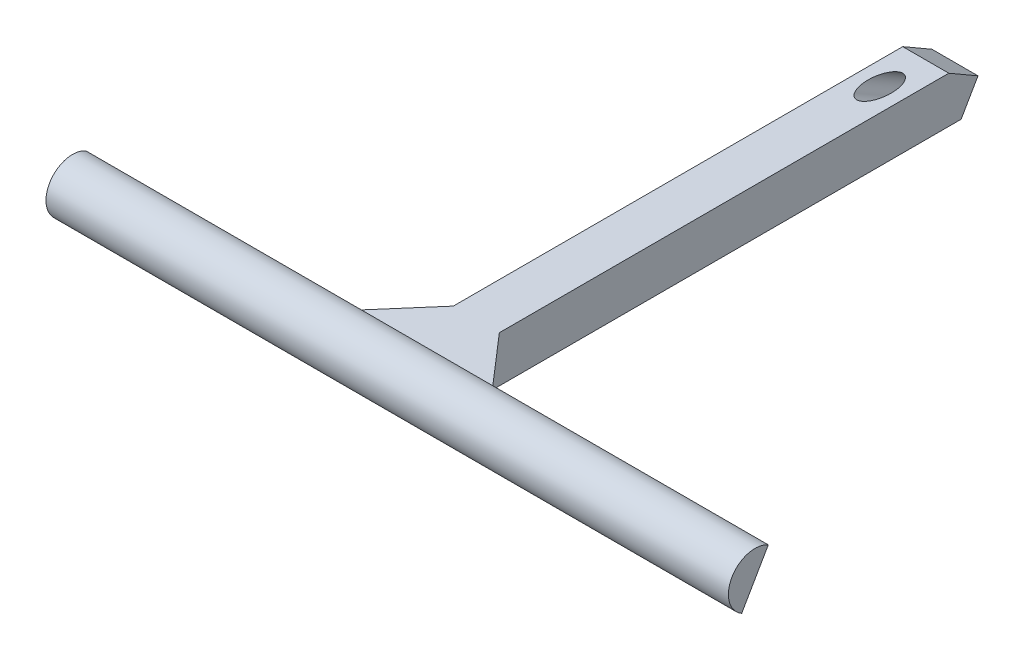
from build123d import *

# Parameters (mm, degrees)
SKETCH_1_W               = 5.4
SKETCH_1_H               = 65
EXTRUDE_1_DEPTH          = 2.7
CUT_EXTRUDE_1_DEPTH      = 33.723538928
CUT_EXTRUDE_1_DEPTH_BACK = 33.723538928
EXTRUDE_2_DEPTH          = 40
CHAMFER_1_SIZE           = 5
CUT_EXTRUDE_2_DEPTH      = 73.576392116
CUT_EXTRUDE_2_DEPTH_BACK = 73.576392116
SKETCH_6_R               = 1.35


with BuildPart() as part:
    # 草图1 → 凸台-拉伸1 (new, symmetric)
    with BuildSketch(Plane(origin=(0, 0, 0), x_dir=(1, 0, 0), z_dir=(0, 1, 0))):
        Rectangle(SKETCH_1_W, SKETCH_1_H)
    extrude(amount=EXTRUDE_1_DEPTH, both=True)

    # 草图3 → 切除-拉伸1 (cut, two sides: drawn at the far end of the back side and taken through both)
    with BuildSketch(Plane(origin=(0, 0, 0), x_dir=(0, 0, -1), z_dir=(1, 0, 0)).offset(-CUT_EXTRUDE_1_DEPTH_BACK)):
        Polygon((29.07653718, 2.7), (32.5, 0.72346282), (32.5, 2.7), align=None)
        Polygon((32.5, -2.7), (32.5, 0.72346282), (30.52346282, -2.7), align=None)
    extrude(amount=CUT_EXTRUDE_1_DEPTH + CUT_EXTRUDE_1_DEPTH_BACK, mode=Mode.SUBTRACT)

    # 草图4 → 凸台-拉伸2 (add, symmetric)
    with BuildSketch(Plane(origin=(0, 0, 0), x_dir=(0, 0, -1), z_dir=(1, 0, 0))):
        with BuildLine():
            ThreePointArc((-29.382308546, 2.7), (-33.641154273, 1.558845727), (-32.5, -2.7))
            Line((-32.5, -2.7), (-29.382308546, 2.7))
        make_face()
    extrude(amount=EXTRUDE_2_DEPTH, both=True)

    # 倒角1
    chamfer_1_edges = [part.edges().sort_by_distance(p)[0] for p in [
        (-2.7, 0, 30.941154273),
        (2.7, 0, 30.941154273),
    ]]
    chamfer(chamfer_1_edges, length=CHAMFER_1_SIZE)

    # 草图6 → 切除-拉伸2 (cut, two sides: drawn at the far end of the back side and taken through both)
    with BuildSketch(Plane(origin=(0, -13.892047107, -24.06173141), x_dir=(-1, 0, 0), z_dir=(0, -0.4999999999999933, -0.8660254037844425)).offset(-CUT_EXTRUDE_2_DEPTH_BACK)):
        with Locations(Location((0, 14.17653718, 0), (0, 0, 90))):
            Circle(SKETCH_6_R)
    extrude(amount=CUT_EXTRUDE_2_DEPTH + CUT_EXTRUDE_2_DEPTH_BACK, mode=Mode.SUBTRACT)


solid = part.part
